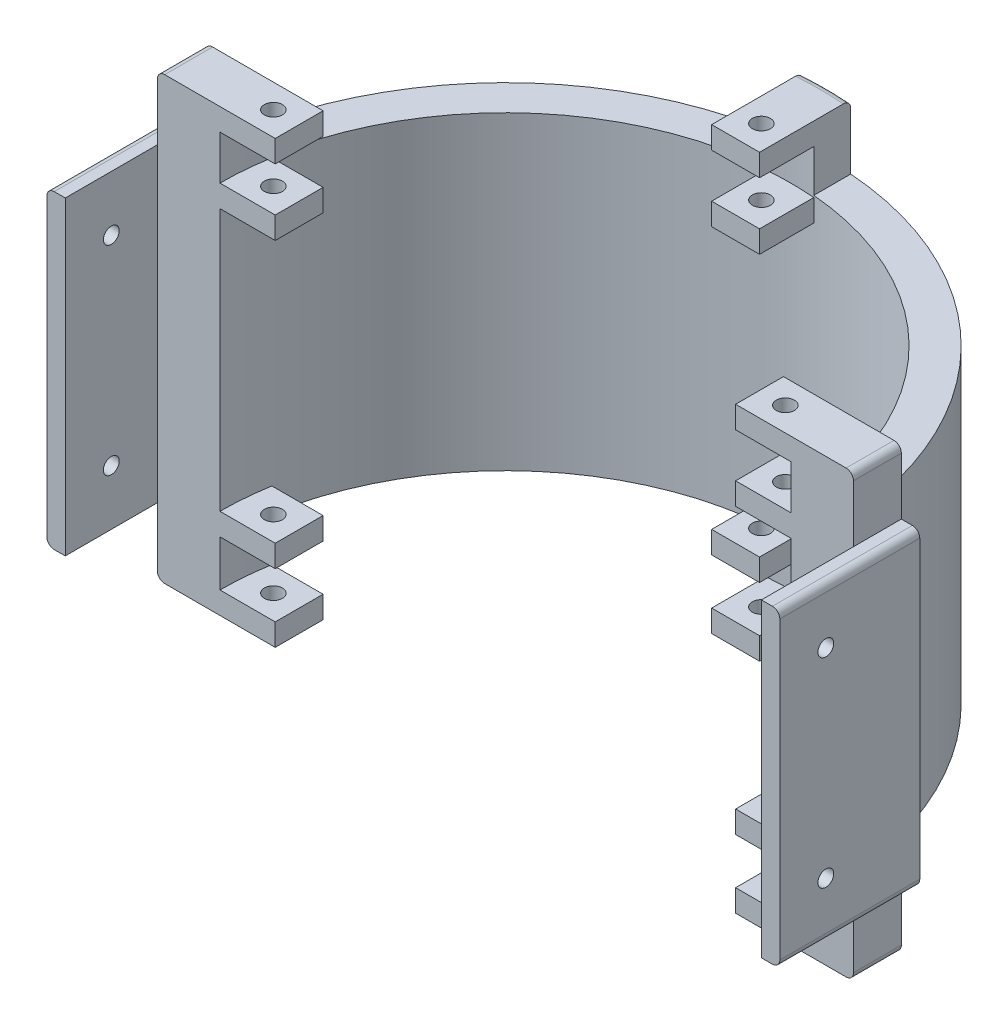
from build123d import *
from build123d.topology import SkipClean

# Parameters (mm, degrees)
BOSS_EXTRUDE1_DEPTH  = 84.17
BOSS_EXTRUDE2_START  = -0.5
SKETCH3_W            = 32
SKETCH3_H            = 13
BOSS_EXTRUDE2_DEPTH  = 6
BOSS_EXTRUDE3_DEPTH  = 11.5
SKETCH5_W            = 32
SKETCH5_H            = 13
BOSS_EXTRUDE4_DEPTH  = 6
SKETCH7_R            = 2.15
CUT_EXTRUDE1_DEPTH   = 240.98758072
BOSS_EXTRUDE5_START  = -0.5
SKETCH9_W            = 30.514448454
SKETCH9_H            = 13
BOSS_EXTRUDE5_DEPTH  = 6
BOSS_EXTRUDE6_START  = 12
BOSS_EXTRUDE6_DEPTH  = 12
SKETCH12_W           = 32
SKETCH12_H           = 13
BOSS_EXTRUDE7_DEPTH  = 6
SKETCH14_R           = 2.45
CUT_EXTRUDE2_DEPTH   = 179.542456856
BOSS_EXTRUDE8_START  = -6.5
BOSS_EXTRUDE8_DEPTH  = 6
BOSS_EXTRUDE9_DEPTH  = 11.5
BOSS_EXTRUDE10_DEPTH = 6
BOSS_EXTRUDE11_START = -0.5
BOSS_EXTRUDE11_DEPTH = 6
BOSS_EXTRUDE12_START = 12
BOSS_EXTRUDE12_DEPTH = 12
BOSS_EXTRUDE13_START = 6
BOSS_EXTRUDE13_DEPTH = 6
SKETCH19_R           = 2.45
CUT_EXTRUDE3_DEPTH   = 179.542456856
FILLET4_R            = 2
FILLET5_R            = 4


with BuildPart() as part:
    # Sketch1 → Boss-Extrude1 (new body)
    with BuildSketch(Plane(origin=(0, 0, 0), x_dir=(1, 0, 0), z_dir=(0, 1, 0))):
        with BuildLine():
            Line((-86.528896907, 13), (-99.5, 13))
            Line((-99.5, 13), (-99.5, -25))
            Line((-99.5, -25), (-94.5, -25))
            Line((-94.5, -25), (-94.5, 0))
            Line((-94.5, 0), (-77.5, 0))
            ThreePointArc((-77.5, 0), (0, 77.5), (77.5, 0))
            Line((77.5, 0), (94.5, 0))
            Line((94.5, 0), (94.5, -25))
            Line((94.5, -25), (99.5, -25))
            Line((99.5, -25), (99.5, 13))
            Line((99.5, 13), (86.528896907, 13))
            ThreePointArc((86.528896907, 13), (0, 87.5), (-86.528896907, 13))
        make_face()
    extrude(amount=BOSS_EXTRUDE1_DEPTH)

    # Sketch3 → Boss-Extrude2 (add)
    with BuildSketch(Plane(origin=(0, 84.17, 0), x_dir=(1, 0, 0), z_dir=(0, 1, 0)).offset(BOSS_EXTRUDE2_START)):
        with Locations((-78.5, 6.5)):
            Rectangle(SKETCH3_W, SKETCH3_H)
        with Locations((78.5, 6.5)):
            Rectangle(SKETCH3_W, SKETCH3_H)
    extrude(amount=-BOSS_EXTRUDE2_DEPTH)

    # Sketch4 → Boss-Extrude3 (add)
    with SkipClean():  # the faces are left unmerged after this step: merging them gives an invalid solid
        with BuildSketch(Plane(origin=(0, 84.17, 0), x_dir=(1, 0, 0), z_dir=(0, 1, 0))):
            with BuildLine():
                Line((-94.5, 13), (-76.401897882, 13))
                ThreePointArc((-76.401897882, 13), (-77.224986519, 6.523147788), (-77.5, 0))
                Line((-77.5, 0), (-94.5, 0))
                Line((-94.5, 0), (-94.5, 13))
            make_face()
            with BuildLine():
                Line((76.401897882, 13), (94.5, 13))
                Line((94.5, 13), (94.5, 0))
                Line((94.5, 0), (77.5, 0))
                ThreePointArc((77.5, 0), (77.224986519, 6.523147788), (76.401897882, 13))
            make_face()
        extrude(amount=BOSS_EXTRUDE3_DEPTH)

    # Sketch5 → Boss-Extrude4 (add)
    with SkipClean():  # the faces are left unmerged after this step: merging them gives an invalid solid
        with BuildSketch(Plane(origin=(0, 95.67, 0), x_dir=(1, 0, 0), z_dir=(0, 1, 0))):
            with Locations((-78.5, 6.5)):
                Rectangle(SKETCH5_W, SKETCH5_H)
            with Locations((78.5, 6.5)):
                Rectangle(SKETCH5_W, SKETCH5_H)
        extrude(amount=BOSS_EXTRUDE4_DEPTH)

    # Sketch7 → Cut-Extrude1 (cut, through all)
    with SkipClean():  # the faces are left unmerged after this step: merging them gives an invalid solid
        with BuildSketch(Plane.ZY.offset(99.5)):
            with Locations((12.5, 69.17)):
                Circle(SKETCH7_R)
            with Locations((12.5, 15)):
                Circle(SKETCH7_R)
        extrude(amount=-CUT_EXTRUDE1_DEPTH, mode=Mode.SUBTRACT)

    # Sketch9 → Boss-Extrude5 (add)
    with SkipClean():  # the faces are left unmerged after this step: merging them gives an invalid solid
        with BuildSketch(Plane.XZ.offset(BOSS_EXTRUDE5_START)):
            with Locations((-77.757224227, -6.5)):
                Rectangle(SKETCH9_W, SKETCH9_H)
            with Locations((77.757224227, -6.5)):
                Rectangle(SKETCH9_W, SKETCH9_H)
        extrude(amount=-BOSS_EXTRUDE5_DEPTH)

    # Sketch11 → Boss-Extrude6 (add)
    with SkipClean():  # the faces are left unmerged after this step: merging them gives an invalid solid
        with BuildSketch(Plane.XZ.offset(BOSS_EXTRUDE6_START)):
            with BuildLine():
                Line((-94.5, 0), (-77.5, 0))
                ThreePointArc((-77.5, 0), (-77.224986519, -6.523147788), (-76.401897882, -13))
                Line((-76.401897882, -13), (-94.5, -13))
                Line((-94.5, -13), (-94.5, 0))
            make_face()
            with BuildLine():
                Line((94.5, 0), (77.5, 0))
                ThreePointArc((77.5, 0), (77.224986519, -6.523147788), (76.401897882, -13))
                Line((76.401897882, -13), (94.5, -13))
                Line((94.5, -13), (94.5, 0))
            make_face()
        extrude(amount=-BOSS_EXTRUDE6_DEPTH)

    # Sketch12 → Boss-Extrude7 (add)
    with SkipClean():  # the faces are left unmerged after this step: merging them gives an invalid solid
        with BuildSketch(Plane.XZ.offset(12)):
            with Locations((-78.5, -6.5)):
                Rectangle(SKETCH12_W, SKETCH12_H)
            with Locations((78.5, -6.5)):
                Rectangle(SKETCH12_W, SKETCH12_H)
        extrude(amount=BOSS_EXTRUDE7_DEPTH)

    # Sketch14 → Cut-Extrude2 (cut, through all)
    with SkipClean():  # the faces are left unmerged after this step: merging them gives an invalid solid
        with BuildSketch(Plane(origin=(0, 101.67, 0), x_dir=(1, 0, 0), z_dir=(0, 1, 0))):
            with Locations((-69.5, 6.5)):
                Circle(SKETCH14_R)
            with Locations((69.5, 6.5)):
                Circle(SKETCH14_R)
        extrude(amount=-CUT_EXTRUDE2_DEPTH, mode=Mode.SUBTRACT)

    # Sketch15 → Boss-Extrude8 (add)
    with SkipClean():  # the faces are left unmerged after this step: merging them gives an invalid solid
        with BuildSketch(Plane(origin=(0, 84.17, 0), x_dir=(1, 0, 0), z_dir=(0, 1, 0)).offset(BOSS_EXTRUDE8_START)):
            with BuildLine():
                Line((-6.5, 77.226938305), (-6.5, 62.5))
                Line((-6.5, 62.5), (6.5, 62.5))
                Line((6.5, 62.5), (6.5, 77.226938305))
                ThreePointArc((6.5, 77.226938305), (0, 77.5), (-6.5, 77.226938305))
            make_face()
        extrude(amount=BOSS_EXTRUDE8_DEPTH)

    # Sketch17 → Boss-Extrude9 (add)
    with SkipClean():  # the faces are left unmerged after this step: merging them gives an invalid solid
        with BuildSketch(Plane(origin=(0, 84.17, 0), x_dir=(1, 0, 0), z_dir=(0, 1, 0))):
            with BuildLine():
                Line((-6.5, 77.226938305), (-6.5, 87.258237433))
                ThreePointArc((-6.5, 87.258237433), (0, 87.5), (6.5, 87.258237433))
                Line((6.5, 87.258237433), (6.5, 77.226938305))
                ThreePointArc((6.5, 77.226938305), (0, 77.5), (-6.5, 77.226938305))
            make_face()
        extrude(amount=BOSS_EXTRUDE9_DEPTH)

    # Sketch18 → Boss-Extrude10 (add)
    with SkipClean():  # the faces are left unmerged after this step: merging them gives an invalid solid
        with BuildSketch(Plane(origin=(0, 95.67, 0), x_dir=(1, 0, 0), z_dir=(0, 1, 0))):
            with BuildLine():
                Line((-6.5, 87.258237433), (-6.5, 62.5))
                Line((-6.5, 62.5), (6.5, 62.5))
                Line((6.5, 62.5), (6.5, 87.258237433))
                ThreePointArc((6.5, 87.258237433), (0, 87.5), (-6.5, 87.258237433))
            make_face()
        extrude(amount=BOSS_EXTRUDE10_DEPTH)

    # Sketch20 → Boss-Extrude11 (add)
    with SkipClean():  # the faces are left unmerged after this step: merging them gives an invalid solid
        with BuildSketch(Plane.XZ.offset(BOSS_EXTRUDE11_START)):
            with BuildLine():
                Line((-6.5, -62.5), (6.5, -62.5))
                Line((6.5, -62.5), (6.5, -87.258237433))
                ThreePointArc((6.5, -87.258237433), (0, -87.5), (-6.5, -87.258237433))
                Line((-6.5, -87.258237433), (-6.5, -62.5))
            make_face()
        extrude(amount=-BOSS_EXTRUDE11_DEPTH)

    # Sketch21 → Boss-Extrude12 (add)
    with SkipClean():  # the faces are left unmerged after this step: merging them gives an invalid solid
        with BuildSketch(Plane.XZ.offset(BOSS_EXTRUDE12_START)):
            with BuildLine():
                Line((-6.5, -77.226938305), (-6.5, -87.258237433))
                ThreePointArc((-6.5, -87.258237433), (0, -87.5), (6.5, -87.258237433))
                Line((6.5, -87.258237433), (6.5, -77.226938305))
                ThreePointArc((6.5, -77.226938305), (0, -77.5), (-6.5, -77.226938305))
            make_face()
        extrude(amount=-BOSS_EXTRUDE12_DEPTH)

    # Sketch22 → Boss-Extrude13 (add)
    with SkipClean():  # the faces are left unmerged after this step: merging them gives an invalid solid
        with BuildSketch(Plane.XZ.offset(12).offset(BOSS_EXTRUDE13_START)):
            with BuildLine():
                Line((-6.5, -87.258237433), (-6.5, -62.5))
                Line((-6.5, -62.5), (6.5, -62.5))
                Line((6.5, -62.5), (6.5, -87.258237433))
                ThreePointArc((6.5, -87.258237433), (0, -87.5), (-6.5, -87.258237433))
            make_face()
        extrude(amount=-BOSS_EXTRUDE13_DEPTH)

    # Sketch19 → Cut-Extrude3 (cut, through all)
    with SkipClean():  # the faces are left unmerged after this step: merging them gives an invalid solid
        with BuildSketch(Plane(origin=(0, 101.67, 0), x_dir=(1, 0, 0), z_dir=(0, 1, 0))):
            with Locations((0, 69.5)):
                Circle(SKETCH19_R)
        extrude(amount=-CUT_EXTRUDE3_DEPTH, mode=Mode.SUBTRACT)

    # Fillet4
    fillet4_edges = [part.edges().sort_by_distance(p)[0] for p in [
        (99.5, 0, 6),
        (94.5, -18, -6.5),
        (0, -18, -87.5),
        (-99.5, 0, 6),
        (-94.5, -18, -6.5),
        (-99.5, 84.17, 6),
        (99.5, 84.17, 6),
        (94.5, 101.67, -6.5),
        (0, 101.67, -87.5),
        (-94.5, 101.67, -6.5),
    ]]
    fillet(fillet4_edges, radius=FILLET4_R)

    # Fillet5
    fillet5_edges = [part.edges().sort_by_distance(p)[0] for p in [
        (-86.528896907, 42.085, -13),
        (86.528896907, 42.085, -13),
    ]]
    fillet(fillet5_edges, radius=FILLET5_R)


solid = part.part
